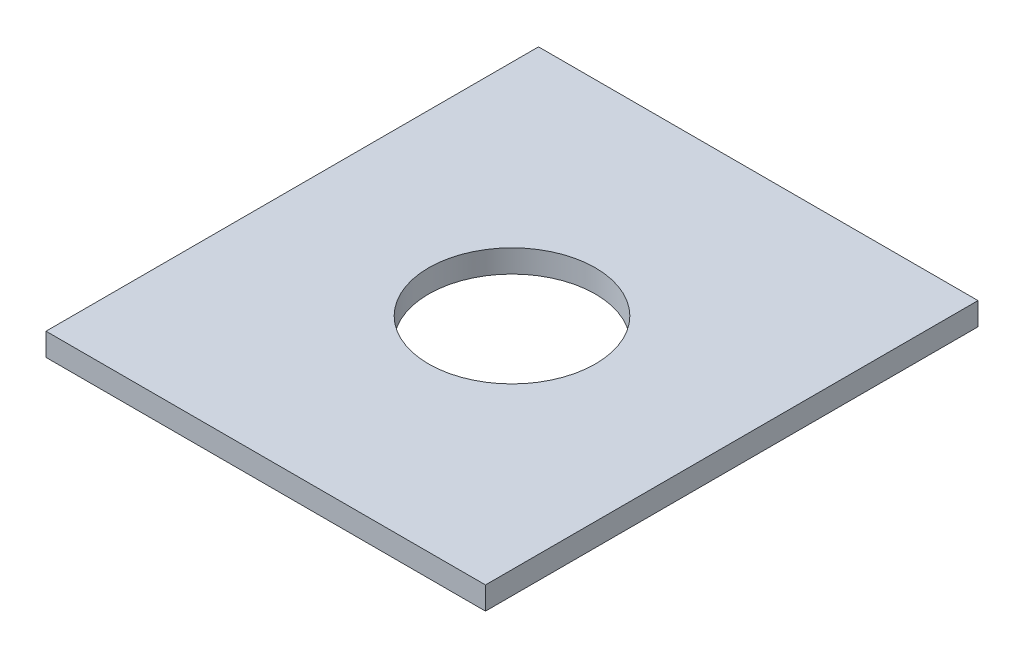
from build123d import *

# Parameters (mm, degrees)
SKETCH3_W           = 58
SKETCH3_H           = 65
SKETCH3_R           = 11
BOSS_EXTRUDE1_DEPTH = 3


with BuildPart() as part:
    # Sketch3 → Boss-Extrude1 (new body)
    with BuildSketch(Plane(origin=(0, 0, 0), x_dir=(1, 0, 0), z_dir=(0, 1, 0))):
        with Locations((0, 8.5e-08)):
            Rectangle(SKETCH3_W, SKETCH3_H)
        with Locations(Location((0, 0, 0), (0, 0, 270))):
            Circle(SKETCH3_R, mode=Mode.SUBTRACT)
    extrude(amount=BOSS_EXTRUDE1_DEPTH)


solid = part.part
